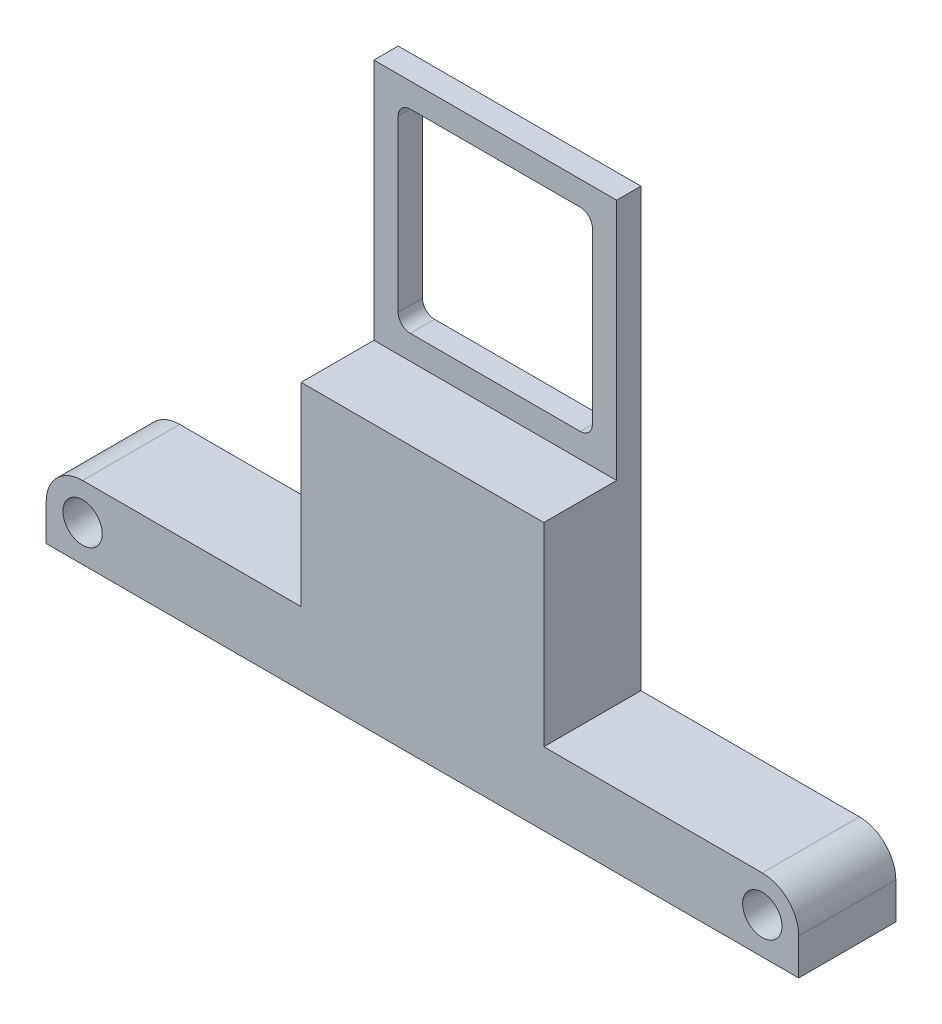
from build123d import *

# Parameters (mm, degrees)
SKETCH1_R           = 4.05
BOSS_EXTRUDE1_DEPTH = 10
SKETCH3_W           = 50
SKETCH3_H           = 50
CUT_EXTRUDE2_DEPTH  = 15
SKETCH4_W           = 40
SKETCH4_H           = 40
CUT_EXTRUDE3_DEPTH  = 132.363046554
FILLET1_R           = 2.5


with BuildPart() as part:
    # Sketch1 → Boss-Extrude1 (new, symmetric)
    with BuildSketch(Plane.XY):
        with BuildLine():
            Line((-77.5, 0), (77.5, 0))
            Line((77.5, 0), (77.5, 7.5))
            ThreePointArc((77.5, 7.5), (75.303300859, 12.803300859), (70, 15))
            Line((70, 15), (25, 15))
            Line((25, 15), (25, 105))
            Line((25, 105), (-25, 105))
            Line((-25, 105), (-25, 15))
            Line((-25, 15), (-70, 15))
            ThreePointArc((-70, 15), (-75.303300859, 12.803300859), (-77.5, 7.5))
            Line((-77.5, 7.5), (-77.5, 0))
        make_face()
        with Locations((-70, 7.5)):
            Circle(SKETCH1_R, mode=Mode.SUBTRACT)
        with Locations((70, 7.5)):
            Circle(SKETCH1_R, mode=Mode.SUBTRACT)
    extrude(amount=BOSS_EXTRUDE1_DEPTH, both=True)

    # Sketch3 → Cut-Extrude2 (cut)
    with BuildSketch(Plane.XY.offset(10)):
        with Locations((0, 80)):
            Rectangle(SKETCH3_W, SKETCH3_H)
    extrude(amount=-CUT_EXTRUDE2_DEPTH, mode=Mode.SUBTRACT)

    # Sketch4 → Cut-Extrude3 (cut, through all)
    with BuildSketch(Plane.XY.offset(-5)):
        with Locations((0, 80)):
            Rectangle(SKETCH4_W, SKETCH4_H)
    extrude(amount=-CUT_EXTRUDE3_DEPTH, mode=Mode.SUBTRACT)

    # Fillet1
    fillet1_edges = [part.edges().sort_by_distance(p)[0] for p in [
        (-20, 60, -7.5),
        (-20, 100, -7.5),
        (20, 100, -7.5),
        (20, 60, -7.5),
    ]]
    fillet(fillet1_edges, radius=FILLET1_R)


solid = part.part
